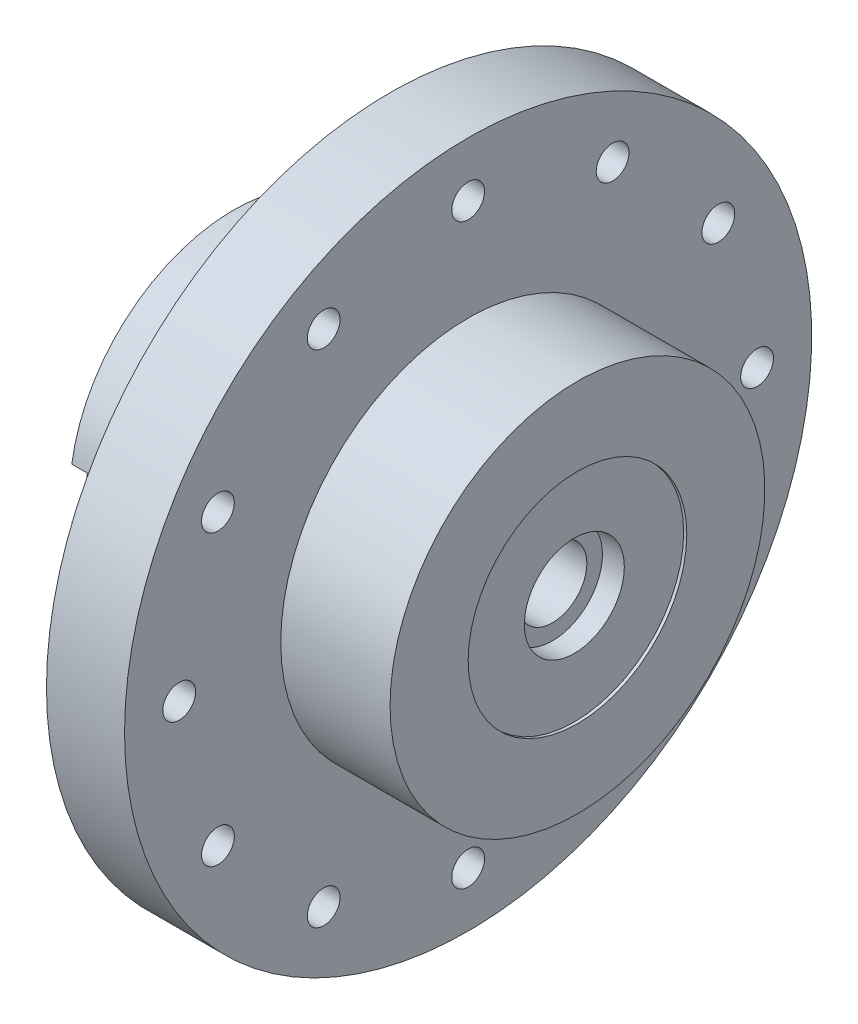
from build123d import *

# Parameters (mm, degrees)
SKETCH2_R          = 35
CUT_EXTRUDE1_DEPTH = 1
CUT_EXTRUDE2_REACH = 174.699
SKETCH3_R          = 5.25
CIRPATTERN1_COUNT  = 12
SKETCH9_R          = 5
CUT_EXTRUDE3_DEPTH = 10
CIRPATTERN2_COUNT  = 4
CIRPATTERN2_ANGLE  = 180


with BuildPart() as part:
    # Sketch1 → Revolve1 (revolve)
    with BuildSketch(Plane.XY, mode=Mode.PRIVATE) as revolve1_sk:
        Polygon((-290.135135135, 60), (-325.135135135, 60), (-325.135135135, 110), (-350.135135135, 110), (-350.135135135, 80), (-369.135135135, 80), (-369.135135135, 52.5), (-400.135135135, 52.5), (-400.135135135, 0), (-290.135135135, 0), align=None)
    revolve(revolve1_sk.sketch.rotate(Axis((-400.135135135, 0, 0), (1, 0, 0)), 90), axis=Axis((-400.135135135, 0, 0), (1, 0, 0)))

    # Sketch2 → Cut-Extrude1 (cut)
    with BuildSketch(Plane(origin=(-290.135135135, 0, 0), x_dir=(0, 0, -1), z_dir=(1, 0, 0))):
        Circle(SKETCH2_R)
    extrude(amount=-CUT_EXTRUDE1_DEPTH, mode=Mode.SUBTRACT)

    # Sketch3 → Cut-Extrude2 (cut, up to next)
    with BuildSketch(Plane(origin=(-325.135135135, 0, 0), x_dir=(0, 0, -1), z_dir=(1, 0, 0)), mode=Mode.PRIVATE) as cut_extrude2_sk1:
        with Locations((0, 92.5)):
            Circle(SKETCH3_R)
    cut_extrude2_tool1 = extrude(cut_extrude2_sk1.sketch, amount=-CUT_EXTRUDE2_REACH, mode=Mode.PRIVATE) & part.part
    cut_extrude2 = cut_extrude2_tool1.solids().sort_by_distance((-325.135135, 92.5, 0))[0]
    add(cut_extrude2, mode=Mode.SUBTRACT)

    # CirPattern1: Cut-Extrude2 ×12 about axis
    cirpattern1_axis = Axis((0, 0, 0), (1, 0, 0))
    for i in range(1, CIRPATTERN1_COUNT):
        add(cut_extrude2.rotate(cirpattern1_axis, i * 360 / CIRPATTERN1_COUNT), mode=Mode.SUBTRACT)

    # Sketch4 → Cut-Revolve1 (revolve, cut)
    with BuildSketch(Plane.XY, mode=Mode.PRIVATE) as cut_revolve1_sk:
        Polygon((-291.135135135, 16), (-298.135135135, 16), (-298.135135135, 11), (-328.635135135, 11), (-328.635135135, 17), (-353.635135135, 17), (-353.635135135, 11), (-374.135135135, 11), (-374.135135135, 16), (-381.135135135, 16), (-381.135135135, 0), (-291.135135135, 0), align=None)
    revolve(cut_revolve1_sk.sketch.rotate(Axis((-291.135135135, 0, 0), (-1, 0, 0)), 90), axis=Axis((-291.135135135, 0, 0), (-1, 0, 0)), mode=Mode.SUBTRACT)

    # Sketch8 → Cut-Revolve2 (revolve, cut)
    with BuildSketch(Plane.XY.offset(38), mode=Mode.PRIVATE) as cut_revolve2_sk:
        Polygon((-400.135135135, 0), (-313.135135135, 0), (-313.135135135, 16), (-320.135135135, 16), (-320.135135135, 11), (-332.635135135, 11), (-332.635135135, 30), (-352.635135135, 30), (-352.635135135, 11), (-395.135135135, 11), (-395.135135135, 16), (-400.135135135, 16), align=None)
    revolve(cut_revolve2_sk.sketch.rotate(Axis((-400.135135135, 0, 38), (1, 0, 0)), 90), axis=Axis((-400.135135135, 0, 38), (1, 0, 0)), mode=Mode.SUBTRACT)

    # Sketch9 → Cut-Extrude3 (cut)
    with BuildSketch(Plane.ZY.offset(400.135135135)):
        with Locations((0, 30)):
            Circle(SKETCH9_R)
    cut_extrude3 = extrude(amount=-CUT_EXTRUDE3_DEPTH, mode=Mode.SUBTRACT)

    # CirPattern2: Cut-Extrude3 ×4 about axis
    cirpattern2_axis = Axis((0, 0, 0), (-1, 0, 0))
    for i in range(1, CIRPATTERN2_COUNT):
        add(cut_extrude3.rotate(cirpattern2_axis, i * CIRPATTERN2_ANGLE / (CIRPATTERN2_COUNT - 1)), mode=Mode.SUBTRACT)


solid = part.part
